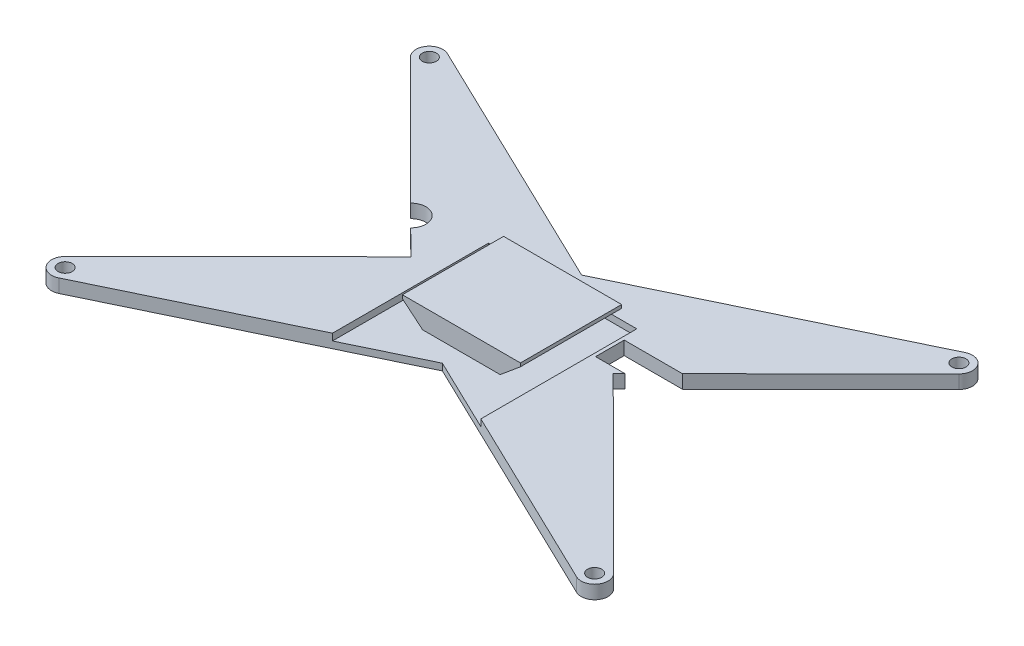
from build123d import *

# Parameters (mm, degrees)
BOSS_EXTRUDE1_DEPTH = 2
BOSS_EXTRUDE2_DEPTH = 5
SKETCH5_W           = 35
SKETCH5_H           = 30.000000000000004
BOSS_EXTRUDE3_DEPTH = 1
BOSS_EXTRUDE4_DEPTH = 30
BOSS_EXTRUDE5_START = 2
SKETCH8_R           = 2.100000000000005
BOSS_EXTRUDE5_DEPTH = 2
SKETCH9_R           = 4.499999999999998
CUT_EXTRUDE1_DEPTH  = 33
CHAMFER1_SIZE       = 0.5


with BuildPart() as part:
    # Sketch2 → Boss-Extrude1 (new body)
    with BuildSketch(Plane(origin=(0, 0, 0), x_dir=(1, 0, 0), z_dir=(0, 1, 0))):
        Polygon((30.00000000000002, 3.36e-15), (0, 2.082e-14), (0, -20.636942675159247), (30, -20.636942675159247), align=None)
        Polygon((30, 20.636942675159247), (0, 20.636942675159247), (0, 2.132e-14), (30.00000000000002, 3.36e-15), align=None)
        with BuildLine():
            Line((74.5, 54), (69.28076131840885, 54))
            Line((69.28076131840886, 54), (0, 20.636942675159247))
            Line((0, 20.636942675159247), (30, 20.636942675159247))
            Line((30, 20.636942675159247), (30, 3.55e-15))
            Line((30.00000000000002, 3.36e-15), (78.5, 48.35178287541551))
            Line((78.5, 48.35178287541549), (78.5, 49.99999999999999))
            ThreePointArc((78.5, 49.99999999999999), (75.6715728752538, 51.17157287525381), (74.5, 54))
        make_face()
        with BuildLine():
            Line((78.5, -48.35178287541551), (30.00000000000002, 3.36e-15))
            Line((30, 3.55e-15), (30, -20.636942675159247))
            Line((30, -20.636942675159247), (0, -20.636942675159247))
            Line((0, -20.636942675159247), (69.28076131840886, -54))
            Line((69.28076131840885, -54), (74.5, -54))
            ThreePointArc((74.5, -54), (75.6715728752538, -51.1715728752538), (78.5, -49.99999999999999))
            Line((78.5, -50), (78.5, -48.351782875415495))
        make_face()
        with BuildLine():
            Line((76.76449877776258, 57.603891716965485), (69.28076131840886, 54))
            Line((69.28076131840885, 54), (74.5, 54))
            ThreePointArc((74.5, 54), (75.11311316332021, 56.12814415759957), (76.76449877776258, 57.60389171696549))
        make_face()
        with BuildLine():
            ThreePointArc((81.32409533436207, 51.16724770895258), (80.02790556576811, 50.30331167366048), (78.5, 49.99999999999999))
            Line((78.5, 49.99999999999999), (78.5, 48.35178287541549))
            Line((78.5, 48.35178287541551), (81.32409533436207, 51.16724770895259))
        make_face()
        with BuildLine():
            ThreePointArc((76.76449877776258, 57.60389171696549), (75.11311316332021, 56.12814415759957), (74.5, 54))
            Line((74.5, 54), (76.39999999999998, 54))
            ThreePointArc((76.39999999999999, 54), (78.5, 56.10000000000001), (80.60000000000001, 54))
            ThreePointArc((80.60000000000001, 54), (79.98492424049172, 52.515075759508214), (78.49999999999991, 51.89999999999999))
            Line((78.5, 51.89999999999999), (78.5, 49.99999999999999))
            ThreePointArc((78.5, 49.99999999999999), (80.02790556576811, 50.30331167366048), (81.32409533436207, 51.16724770895258))
            ThreePointArc((81.32409533436207, 51.16724770895258), (82.19434577005512, 52.46643900307948), (82.5, 54))
            ThreePointArc((82.5, 54), (80.62814415759956, 57.38688683667979), (76.76449877776258, 57.60389171696549))
        make_face()
        with BuildLine():
            Line((76.39999999999998, 54), (74.5, 54))
            ThreePointArc((74.5, 54), (75.6715728752538, 51.17157287525381), (78.5, 49.99999999999999))
            Line((78.5, 49.99999999999999), (78.5, 51.89999999999999))
            ThreePointArc((78.49999999999991, 51.89999999999999), (77.01507575950822, 52.51507575950828), (76.39999999999999, 54))
        make_face()
        with BuildLine():
            Line((74.5, -54), (69.28076131840885, -54))
            Line((69.28076131840886, -54), (76.76449877776258, -57.603891716965485))
            ThreePointArc((76.76449877776258, -57.60389171696549), (75.11311316332021, -56.12814415759957), (74.5, -54))
        make_face()
        with BuildLine():
            Line((81.32409533436207, -51.16724770895259), (78.5, -48.35178287541551))
            Line((78.5, -48.351782875415495), (78.5, -50))
            ThreePointArc((78.5, -49.99999999999999), (80.02790556576811, -50.30331167366048), (81.32409533436207, -51.16724770895258))
        make_face()
        with BuildLine():
            ThreePointArc((81.32409533436207, -51.16724770895258), (80.02790556576811, -50.30331167366048), (78.5, -49.99999999999999))
            Line((78.5, -50), (78.5, -51.89999999999999))
            ThreePointArc((78.50000000000009, -51.89999999999999), (79.98492424049178, -52.51507575950828), (80.60000000000001, -54))
            ThreePointArc((80.60000000000001, -54), (78.5, -56.10000000000001), (76.39999999999999, -54))
            Line((76.39999999999998, -54), (74.5, -54))
            ThreePointArc((74.5, -54), (75.11311316332021, -56.12814415759957), (76.76449877776258, -57.60389171696549))
            ThreePointArc((76.76449877776258, -57.60389171696549), (80.62814415759956, -57.38688683667979), (82.5, -54))
            ThreePointArc((82.5, -54), (82.19434577005512, -52.46643900307948), (81.32409533436207, -51.16724770895258))
        make_face()
        with BuildLine():
            Line((78.5, -51.89999999999999), (78.5, -50))
            ThreePointArc((78.5, -49.99999999999999), (75.6715728752538, -51.1715728752538), (74.5, -54))
            Line((74.5, -54), (76.39999999999998, -54))
            ThreePointArc((76.39999999999999, -54), (77.01507575950828, -52.515075759508214), (78.50000000000009, -51.89999999999999))
        make_face()
        with BuildLine():
            Line((-69.28076131840886, 54), (-74.5, 54))
            ThreePointArc((-74.5, 54), (-75.67157287525379, 51.17157287525382), (-78.49999999999994, 49.99999999999999))
            Line((-78.5, 49.99999999999999), (-78.5, 48.35178287541549))
            Line((-78.49999999999997, 48.35178287541548), (-30.00000000000002, 1.878e-14))
            Line((-30.00000000000002, 1.878e-14), (-78.50000000000001, -48.3517828754155))
            Line((-78.5, -48.351782875415495), (-78.5, -50))
            ThreePointArc((-78.49999999999994, -49.99999999999999), (-75.67157287525379, -51.17157287525382), (-74.5, -54))
            Line((-74.5, -54), (-69.28076131840886, -54))
            Line((-69.28076131840888, -54.00000000000001), (0, -20.636942675159247))
            Line((0, -20.636942675159247), (0, 2.132e-14))
            Line((0, 2.132e-14), (0, 20.636942675159247))
            Line((0, 20.636942675159247), (-69.28076131840888, 54.00000000000001))
        make_face()
        with BuildLine():
            ThreePointArc((-74.5, -54), (-75.67157287525379, -51.17157287525382), (-78.49999999999994, -49.99999999999999))
            Line((-78.5, -50), (-78.5, -51.89999999999999))
            ThreePointArc((-78.49999999999991, -51.89999999999999), (-77.01507575950822, -52.51507575950828), (-76.39999999999999, -54))
            Line((-76.39999999999999, -54), (-74.5, -54))
        make_face()
        with BuildLine():
            Line((-78.5, -51.89999999999999), (-78.5, -50))
            ThreePointArc((-78.49999999999994, -49.99999999999999), (-80.0279055657681, -50.30331167366047), (-81.32409533436207, -51.16724770895258))
            ThreePointArc((-81.32409533436207, -51.16724770895258), (-81.76402448010279, -56.312173045706096), (-76.76449877776258, -57.60389171696549))
            ThreePointArc((-76.76449877776258, -57.60389171696549), (-75.11311316332021, -56.12814415759957), (-74.5, -54))
            Line((-74.5, -54), (-76.39999999999999, -54))
            ThreePointArc((-76.39999999999999, -54), (-79.98492424049178, -55.48492424049172), (-78.49999999999991, -51.89999999999999))
        make_face()
        with BuildLine():
            Line((-69.28076131840886, -54), (-74.5, -54))
            ThreePointArc((-74.5, -54), (-75.11311316332021, -56.12814415759957), (-76.76449877776258, -57.60389171696549))
            Line((-76.76449877776258, -57.603891716965485), (-69.28076131840888, -54.00000000000001))
        make_face()
        with BuildLine():
            Line((-78.5, -50), (-78.5, -48.351782875415495))
            Line((-78.50000000000001, -48.3517828754155), (-81.32409533436207, -51.16724770895259))
            ThreePointArc((-81.32409533436207, -51.16724770895258), (-80.0279055657681, -50.30331167366047), (-78.49999999999994, -49.99999999999999))
        make_face()
        with BuildLine():
            ThreePointArc((-78.50000000000009, 51.89999999999999), (-79.98492424049172, 55.484924240491786), (-76.39999999999999, 54))
            Line((-76.39999999999999, 54), (-74.5, 54))
            ThreePointArc((-74.5, 54), (-75.11311316332021, 56.12814415759957), (-76.76449877776258, 57.60389171696549))
            ThreePointArc((-76.76449877776258, 57.60389171696549), (-81.76402448010279, 56.312173045706096), (-81.32409533436208, 51.16724770895258))
            ThreePointArc((-81.32409533436208, 51.16724770895258), (-80.0279055657681, 50.30331167366047), (-78.49999999999994, 49.99999999999999))
            Line((-78.5, 49.99999999999999), (-78.5, 51.89999999999999))
        make_face()
        with BuildLine():
            Line((-74.5, 54), (-76.39999999999999, 54))
            ThreePointArc((-76.39999999999999, 54), (-77.01507575950828, 52.515075759508214), (-78.50000000000009, 51.89999999999999))
            Line((-78.5, 51.89999999999999), (-78.5, 49.99999999999999))
            ThreePointArc((-78.49999999999994, 49.99999999999999), (-75.67157287525379, 51.17157287525382), (-74.5, 54))
        make_face()
        with BuildLine():
            ThreePointArc((-76.76449877776258, 57.60389171696549), (-75.11311316332021, 56.12814415759957), (-74.5, 54))
            Line((-74.5, 54), (-69.28076131840886, 54))
            Line((-69.28076131840888, 54.00000000000001), (-76.76449877776258, 57.603891716965485))
        make_face()
        with BuildLine():
            Line((-78.5, 48.35178287541549), (-78.5, 49.99999999999999))
            ThreePointArc((-78.49999999999994, 49.99999999999999), (-80.0279055657681, 50.30331167366047), (-81.32409533436208, 51.16724770895258))
            Line((-81.32409533436207, 51.16724770895259), (-78.49999999999997, 48.35178287541548))
        make_face()
    extrude(amount=-BOSS_EXTRUDE1_DEPTH)

    # Sketch4 → Boss-Extrude2 (add)
    with BuildSketch(Plane(origin=(0, 0, 0), x_dir=(1, 0, 0), z_dir=(0, 1, 0))):
        Polygon((-11.500000000000004, 15.000000000000002), (11.499999999999996, 15.000000000000002), (11.5, -14.999999999999998), (-11.5, -14.999999999999998), align=None)
    extrude(amount=BOSS_EXTRUDE2_DEPTH)

    # Sketch5 → Boss-Extrude3 (add)
    with BuildSketch(Plane(origin=(0, 5, 0), x_dir=(1, 0, 0), z_dir=(0, 1, 0))):
        Rectangle(SKETCH5_W, SKETCH5_H)
    extrude(amount=BOSS_EXTRUDE3_DEPTH)

    # Sketch6 → Boss-Extrude4 (add)
    with BuildSketch(Plane.XY.offset(14.999999999999998)):
        Polygon((11.5, 0), (17.499999999999996, 5), (11.5, 5), align=None)
        Polygon((-17.499999999999996, 5), (-11.5, 5), (-11.5, 0), align=None)
    extrude(amount=-BOSS_EXTRUDE4_DEPTH)

    # Sketch8 → Boss-Extrude5 (add)
    # profile 1 of 2: a face of its own
    with BuildSketch(Plane(origin=(0, 0, 0), x_dir=(1, 0, 0), z_dir=(0, 1, 0)).offset(BOSS_EXTRUDE5_START)):
        with BuildLine():
            Line((-21.999999999999996, 15.000000000000002), (-21.999999999999996, 17.887727530855102))
            Line((-21.999999999999996, 17.887727530855102), (22.000000000000004, 17.887727530855102))
            Line((22.000000000000004, 17.887727530855102), (22.000000000000004, 15.000000000000002))
            Line((22.000000000000004, 15.000000000000002), (22.00000000000001, -17.887727530855102))
            Line((22.00000000000001, -17.887727530855102), (22.00000000000001, -31.23133060015837))
            Line((22.000000000000014, -31.23133060015837), (76.76449877776258, -57.603891716965485))
            ThreePointArc((76.76449877776258, -57.60389171696549), (81.76402448010278, -56.312173045706096), (81.32409533436208, -51.16724770895259))
            Line((81.32409533436208, -51.16724770895258), (30.00000000000002, -1.745e-14))
            Line((30.00000000000002, -1.745e-14), (81.32409533436208, 51.16724770895258))
            ThreePointArc((81.32409533436208, 51.16724770895259), (81.76402448010279, 56.3121730457061), (76.76449877776258, 57.603891716965485))
            Line((76.76449877776258, 57.603891716965485), (0, 20.636942675159247))
            Line((0, 20.636942675159247), (-76.76449877776258, 57.603891716965485))
            ThreePointArc((-76.76449877776258, 57.60389171696549), (-81.76402448010278, 56.31217304570609), (-81.32409533436207, 51.16724770895258))
            Line((-81.32409533436207, 51.16724770895258), (-30.00000000000002, 2.082e-14))
            Line((-30.00000000000002, 2.082e-14), (-81.32409533436207, -51.16724770895257))
            ThreePointArc((-81.32409533436207, -51.16724770895257), (-81.76402448010279, -56.31217304570609), (-76.76449877776258, -57.60389171696549))
            Line((-76.76449877776258, -57.603891716965485), (-21.999999999999996, -31.23133060015836))
            Line((-21.99999999999999, -31.23133060015836), (-21.99999999999999, -17.887727530855102))
            Line((-21.99999999999999, -17.887727530855102), (-21.999999999999996, 15.000000000000002))
        make_face()
        with Locations(Location((-78.5, -54, 0), (0, 0, 270))):
            Circle(SKETCH8_R, mode=Mode.SUBTRACT)
        with Locations(Location((78.5, -54, 0), (0, 0, 270))):
            Circle(SKETCH8_R, mode=Mode.SUBTRACT)
        with Locations(Location((-78.5, 54, 0), (0, 0, 270))):
            Circle(SKETCH8_R, mode=Mode.SUBTRACT)
        with Locations(Location((78.5, 54, 0), (0, 0, 270))):
            Circle(SKETCH8_R, mode=Mode.SUBTRACT)
    # profile 2 of 2: a face of its own
    with BuildSketch(Plane(origin=(0, 0, 0), x_dir=(1, 0, 0), z_dir=(0, 1, 0)).offset(BOSS_EXTRUDE5_START)):
        Polygon((-21.999999999999996, 17.887727530855102), (-21.999999999999996, 15.000000000000002), (22.00000000000001, 15.000000000000002), (22.000000000000004, 17.887727530855102), align=None)
    extrude(amount=-BOSS_EXTRUDE5_DEPTH)

    # Sketch9 → Cut-Extrude1 (cut)
    with BuildSketch(Plane.XZ.offset(2)):
        with Locations((-40.622821091427824, -10.590357503857788)):
            Circle(SKETCH9_R)
        Polygon((49.01959861847579, -1.7512025855193758), (23.019598618475772, -1.7512025855193816), (23.019598618475772, -10.251202585519383), (49.01959861847579, -10.251202585519383), align=None)
    extrude(amount=-CUT_EXTRUDE1_DEPTH, mode=Mode.SUBTRACT)

    # Chamfer1
    chamfer1_edges = [part.edges().sort_by_distance(p)[0] for p in [
        (-80.60000000000001, -2, -54),
        (-78.50000000000009, -2, 56.099999999999994),
        (78.50000000000007, -2, -56.100000000000016),
        (80.6, -2, 54.00000000000003),
    ]]
    chamfer(chamfer1_edges, length=CHAMFER1_SIZE)


solid = part.part
